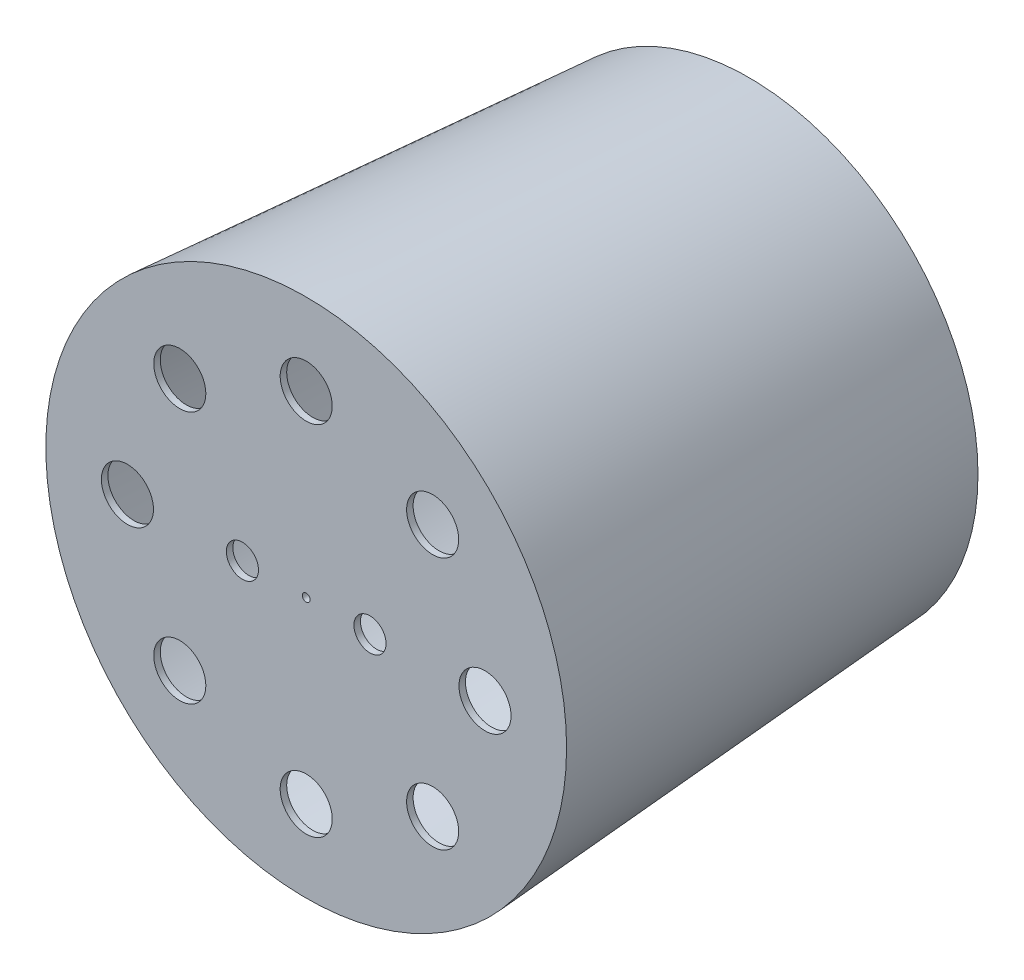
from build123d import *

# Parameters (mm, degrees)
VACIADO1_T            = -2.5
CORTAR_EXTRUIR5_REACH = 223.133
CROQUIS2_R            = 1.5
CROQUIS2_R_2          = 6.175
CROQUIS9_R            = 10
CORTAR_EXTRUIR9_DEPTH = 10


with BuildPart() as part:
    # Croquis1 → Revolución1 (revolve)
    with BuildSketch(Plane(origin=(0, 0, 0), x_dir=(1, 0, 0), z_dir=(0, 1, 0)), mode=Mode.PRIVATE) as revoluci_n1_sk:
        Polygon((0, -85), (0, 85), (-88, 85), (-100, -85), align=None)
    revolve(revoluci_n1_sk.sketch.rotate(Axis((0, 0, 85), (0, 0, -1)), 180), axis=Axis((0, 0, 85), (0, 0, -1)))

    # Vaciado1
    vaciado1_openings = [part.faces().sort_by_distance(p)[0] for p in [
        (0, 0, -85),
    ]]
    offset(amount=VACIADO1_T, openings=vaciado1_openings, kind=Kind.INTERSECTION)

    # Croquis2 → Cortar-Extruir5 (cut, up to next)
    with BuildSketch(Plane.XY.offset(85), mode=Mode.PRIVATE) as cortar_extruir5_sk1:
        Circle(CROQUIS2_R)
    cortar_extruir5_tool1 = extrude(cortar_extruir5_sk1.sketch, amount=-CORTAR_EXTRUIR5_REACH, mode=Mode.PRIVATE) & part.part
    # Croquis2 → Cortar-Extruir5 (cut, up to next)
    with BuildSketch(Plane.XY.offset(85), mode=Mode.PRIVATE) as cortar_extruir5_sk2:
        with Locations((-24.5, 0)):
            Circle(CROQUIS2_R_2)
    cortar_extruir5_tool2 = extrude(cortar_extruir5_sk2.sketch, amount=-CORTAR_EXTRUIR5_REACH, mode=Mode.PRIVATE) & part.part
    # Croquis2 → Cortar-Extruir5 (cut, up to next)
    with BuildSketch(Plane.XY.offset(85), mode=Mode.PRIVATE) as cortar_extruir5_sk3:
        with Locations((24.5, 0)):
            Circle(CROQUIS2_R_2)
    cortar_extruir5_tool3 = extrude(cortar_extruir5_sk3.sketch, amount=-CORTAR_EXTRUIR5_REACH, mode=Mode.PRIVATE) & part.part
    add(cortar_extruir5_tool1.solids().sort_by_distance((0, 0, 85))[0], mode=Mode.SUBTRACT)
    add(cortar_extruir5_tool2.solids().sort_by_distance((-24.5, 0, 85))[0], mode=Mode.SUBTRACT)
    add(cortar_extruir5_tool3.solids().sort_by_distance((24.5, 0, 85))[0], mode=Mode.SUBTRACT)

    # Croquis9 → Cortar-Extruir9 (cut)
    with BuildSketch(Plane.XY.offset(85)):
        with Locations((0, 68.666733176)):
            Circle(CROQUIS9_R)
        with Locations((48.55471267, 48.55471267)):
            Circle(CROQUIS9_R)
        with Locations((68.666733176, 0)):
            Circle(CROQUIS9_R)
        with Locations((48.55471267, -48.55471267)):
            Circle(CROQUIS9_R)
        with Locations((0, -68.666733176)):
            Circle(CROQUIS9_R)
        with Locations((-48.55471267, -48.55471267)):
            Circle(CROQUIS9_R)
        with Locations((-68.666733176, 0)):
            Circle(CROQUIS9_R)
        with Locations((-48.55471267, 48.55471267)):
            Circle(CROQUIS9_R)
    extrude(amount=-CORTAR_EXTRUIR9_DEPTH, mode=Mode.SUBTRACT)


solid = part.part
